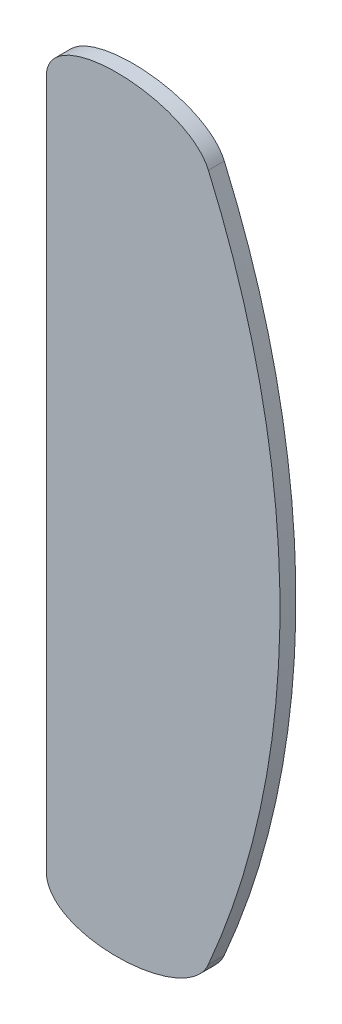
from build123d import *

# Parameters (mm, degrees)
BOSS_EXTRUDE1_DEPTH = 19.05


with BuildPart() as part:
    # Sketch1 → Boss-Extrude1 (new body)
    with BuildSketch(Plane.XY):
        with BuildLine():
            Line((3345.331718462, 2756.602076766), (3345.331718462, 1933.230896671))
            add(Edge.make_bspline(
                [(3539.128242207, 1933.230896671), (3513.324366189, 1874.009529977), (3345.331718462, 1868.632055422), (3345.331718462, 1933.230896671)],
                knots=[0, 0, 0, 0, 7.629784399, 7.629784399, 7.629784399, 7.629784399], degree=3))
            ThreePointArc((3539.128242207, 1933.230896671), (3624.974365803, 2344.893977469), (3539.344406076, 2756.602076766))
            add(Edge.make_bspline(
                [(3539.344406076, 2756.602076766), (3513.542881609, 2815.903055746), (3345.331718462, 2821.272972638), (3345.331718462, 2756.602076766)],
                knots=[0, 0, 0, 0, 7.638294788, 7.638294788, 7.638294788, 7.638294788], degree=3))
        make_face()
    extrude(amount=BOSS_EXTRUDE1_DEPTH)


solid = part.part
